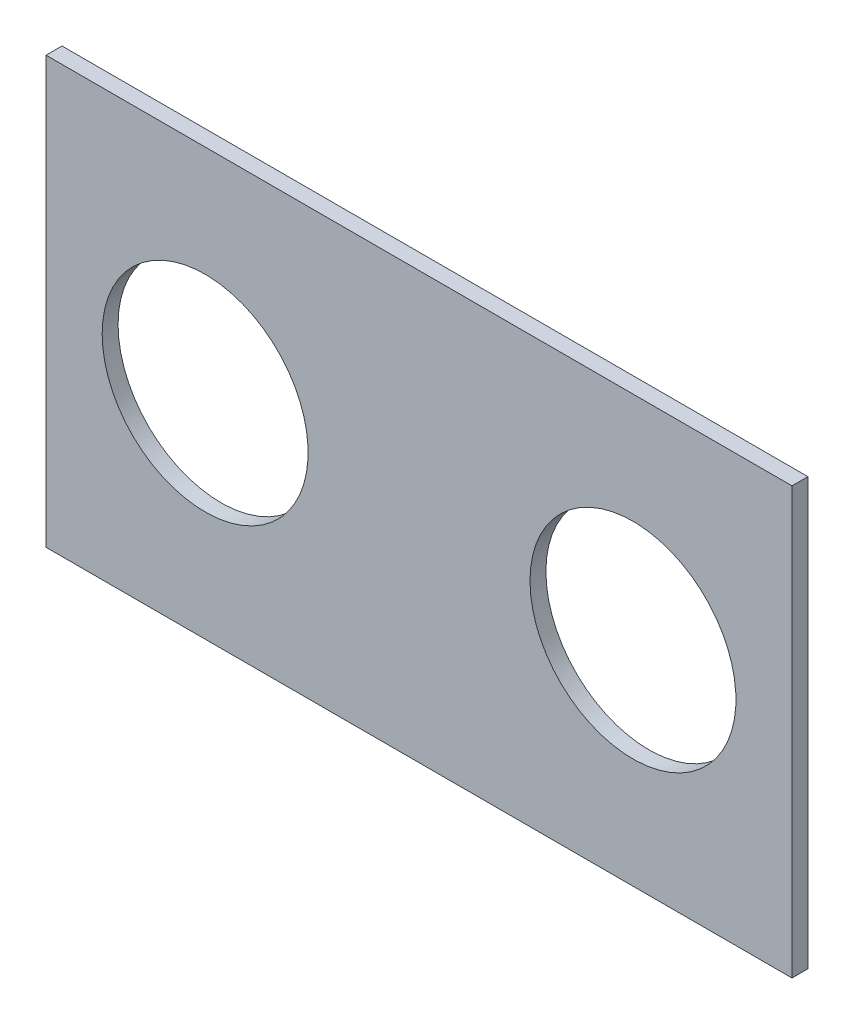
from build123d import *

# Parameters (mm, degrees)
SKETCH1_W           = 88.9
SKETCH1_H           = 50.8
SKETCH1_R           = 12.272596154
BOSS_EXTRUDE1_DEPTH = 1.89738


with BuildPart() as part:
    # Sketch1 → Boss-Extrude1 (new body)
    with BuildSketch(Plane.XY):
        with Locations((25.49525, 0)):
            Rectangle(SKETCH1_W, SKETCH1_H)
        with Locations(Location((0, 0, 0), (0, 0, 180))):
            Circle(SKETCH1_R, mode=Mode.SUBTRACT)
        with Locations(Location((50.9905, 0, 0), (0, 0, 180))):
            Circle(SKETCH1_R, mode=Mode.SUBTRACT)
    extrude(amount=BOSS_EXTRUDE1_DEPTH)


solid = part.part
